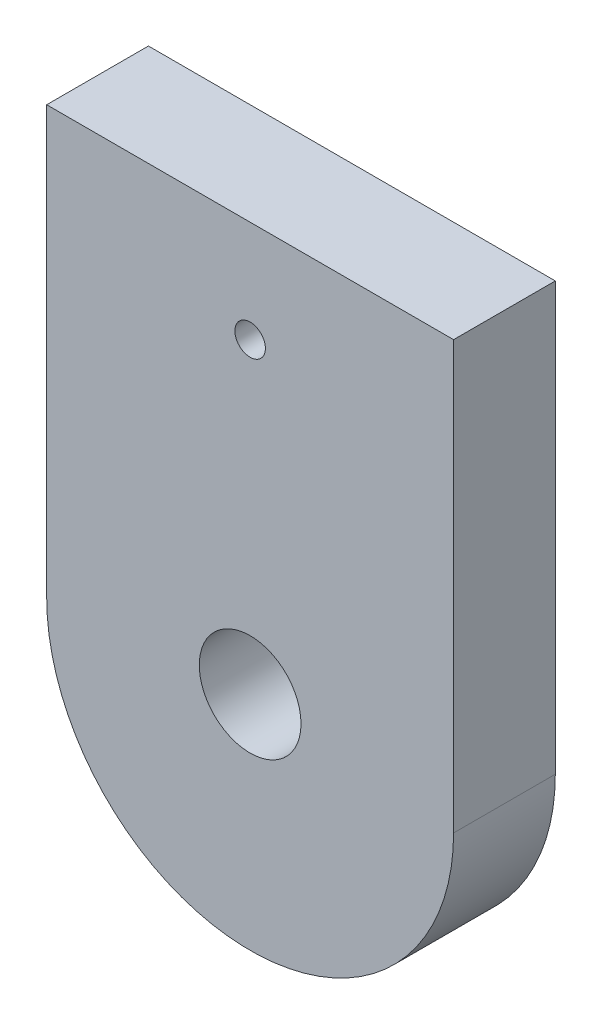
from build123d import *

# Parameters (mm, degrees)
SKETCH1_R               = 1.5
BOSS_EXTRUDE1_DEPTH     = 10
CUT_EXTRUDE1_DEPTH      = 37
CUT_EXTRUDE1_DEPTH_BACK = 24
SKETCH2_R               = 5
CUT_EXTRUDE2_DEPTH      = 27
CUT_EXTRUDE2_DEPTH_BACK = 19
SKETCH3_W               = 102.676723454
SKETCH3_H               = 43.006638415


with BuildPart() as part:
    # Sketch1 → Boss-Extrude1 (new body)
    with BuildSketch(Plane.XY):
        with BuildLine():
            Line((-20, -76.707766284), (-20, -58.504148974))
            Line((-20, -58.504148974), (-120, -58.504148974))
            Line((-120, -58.504148974), (-120, -33.504148974))
            Line((-120, -33.504148974), (-20, -34.707766284))
            Line((-20, -34.707766284), (20, -34.707766284))
            Line((20, -34.707766284), (20, -76.707766284))
            ThreePointArc((20, -76.707766284), (0, -96.707766284), (-20, -76.707766284))
        make_face()
        with Locations((0, -44.707766284)):
            Circle(SKETCH1_R, mode=Mode.SUBTRACT)
        with Locations((-100, -43.745596757)):
            Circle(SKETCH1_R, mode=Mode.SUBTRACT)
    extrude(amount=BOSS_EXTRUDE1_DEPTH)

    # Sketch2 → Cut-Extrude1 (cut, two sides: drawn at the far end of the back side and taken through both)
    with BuildSketch(Plane.XY.offset(10).offset(-CUT_EXTRUDE1_DEPTH_BACK)):
        with Locations((0, -74.90788056)):
            Circle(SKETCH2_R)
    extrude(amount=CUT_EXTRUDE1_DEPTH + CUT_EXTRUDE1_DEPTH_BACK, mode=Mode.SUBTRACT)

    # Sketch3 → Cut-Extrude2 (cut, two sides: drawn at the far end of the back side and taken through both)
    with BuildSketch(Plane.XY.offset(-CUT_EXTRUDE2_DEPTH_BACK)):
        with Locations((-71.338361727, -50.195990653)):
            Rectangle(SKETCH3_W, SKETCH3_H)
    extrude(amount=CUT_EXTRUDE2_DEPTH + CUT_EXTRUDE2_DEPTH_BACK, mode=Mode.SUBTRACT)


solid = part.part
